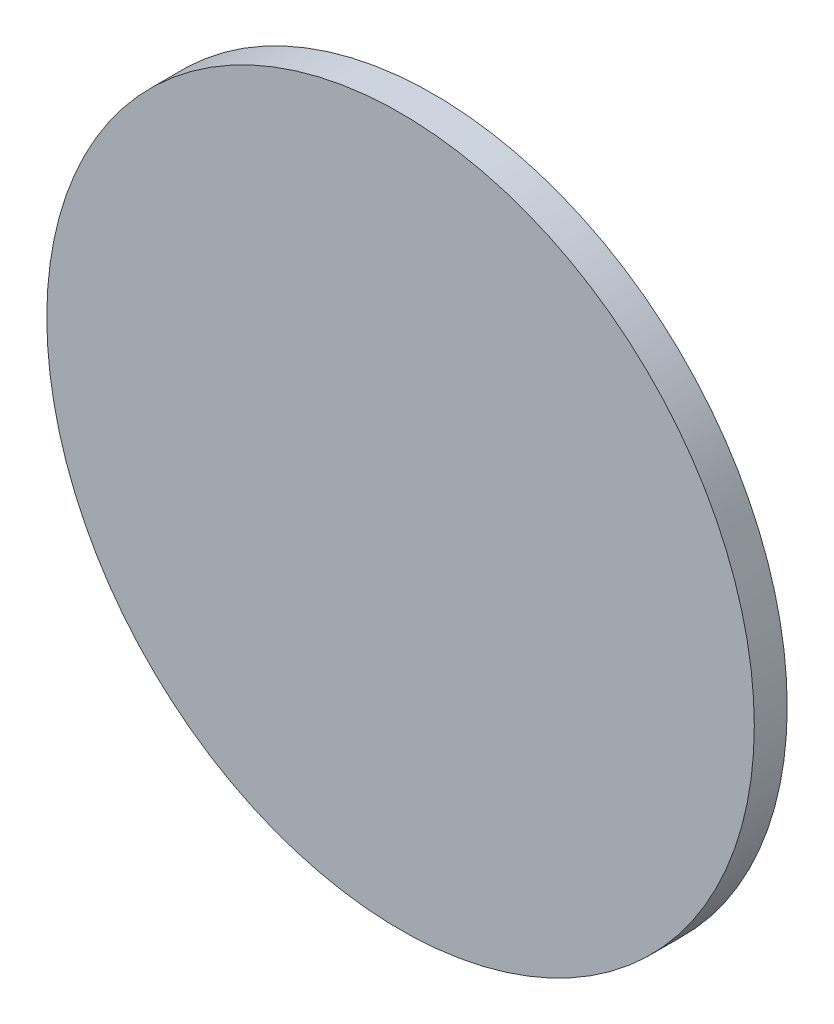
from build123d import *

# Parameters (mm, degrees)
SKETCH_2_R      = 43
EXTRUDE_1_DEPTH = 4


with BuildPart() as part:
    # 草图2 → 凸台-拉伸1 (new body)
    with BuildSketch(Plane.XY):
        Circle(SKETCH_2_R)
    extrude(amount=EXTRUDE_1_DEPTH)


solid = part.part
